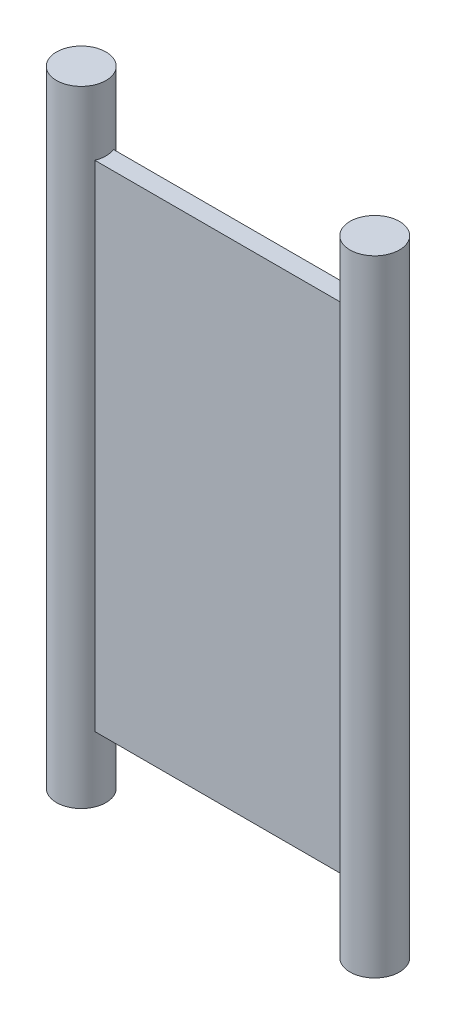
from build123d import *

# Parameters (mm, degrees)
SKETCH1_W           = 15.72
SKETCH1_H           = 1
BOSS_EXTRUDE1_DEPTH = 26.5
SKETCH2_R           = 1.325
BOSS_EXTRUDE2_DEPTH = 16.75


with BuildPart() as part:
    # Sketch1 → Boss-Extrude1 (new body)
    with BuildSketch(Plane(origin=(0, 0, 0), x_dir=(1, 0, 0), z_dir=(0, 1, 0))):
        Rectangle(SKETCH1_W, SKETCH1_H)
    extrude(amount=BOSS_EXTRUDE1_DEPTH)

    # Sketch2 → Boss-Extrude2 (add, symmetric)
    with BuildSketch(Plane(origin=(0, 13.25, 0), x_dir=(1, 0, 0), z_dir=(0, 1, 0))):
        with Locations(Location((-7.86, 0, 0), (0, 0, 270))):
            Circle(SKETCH2_R)
        with Locations(Location((7.86, 0, 0), (0, 0, 270))):
            Circle(SKETCH2_R)
    extrude(amount=BOSS_EXTRUDE2_DEPTH, both=True)


solid = part.part
